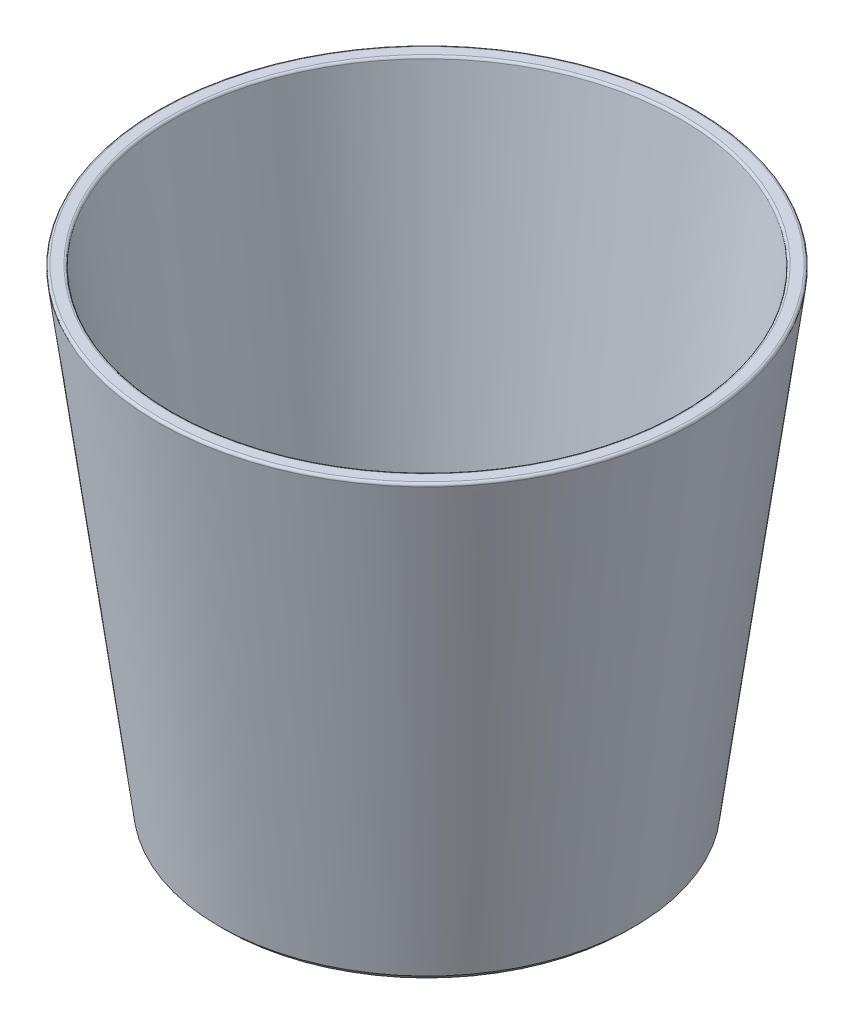
from build123d import *

# Parameters (mm, degrees)
CHAMFER1_SIZE  = 1
CHAMFER1_SIZE2 = 1.161440479
FILLET1_R      = 0.5


with BuildPart() as part:
    # Sketch1 → Revolve1 (revolve)
    with BuildSketch(Plane(origin=(0, 0, 0), x_dir=(0, 0, -1), z_dir=(1, 0, 0)), mode=Mode.PRIVATE) as revolve1_sk:
        Polygon((0, -95), (40, -95), (52.5, 0), (55.525858089, 0), (42.631121247, -98), (0, -98), align=None)
    revolve(revolve1_sk.sketch.rotate(Axis((0, 0, 0), (0, -1, 0)), 180), axis=Axis((0, 0, 0), (0, -1, 0)))

    # Chamfer1
    chamfer1_edges = [part.edges().sort_by_distance(p)[0] for p in [
        (0, -98, -42.631121247),
    ]]
    chamfer1_side = [part.faces().sort_by_distance(p)[0] for p in [
        (0, -98, 0),
    ]]
    chamfer(chamfer1_edges, length=CHAMFER1_SIZE, length2=CHAMFER1_SIZE2, reference=chamfer1_side[0])

    # Fillet1
    fillet1_edges = [part.edges().sort_by_distance(p)[0] for p in [
        (0, 0, -52.5),
        (0, 0, -55.525858089),
    ]]
    fillet(fillet1_edges, radius=FILLET1_R)


solid = part.part
